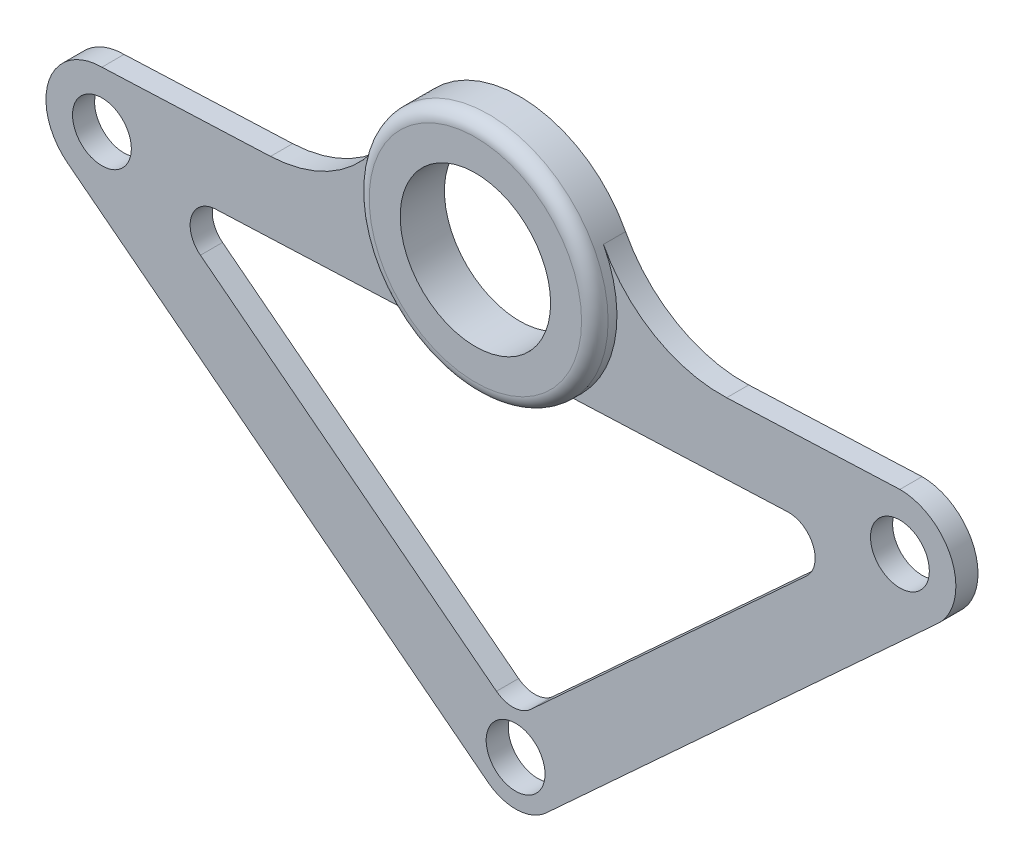
from build123d import *
from build123d.topology import SkipClean

# Parameters (mm, degrees)
SKETCH1_R           = 3.325
SKETCH1_R_2         = 8.5
BOSS_EXTRUDE1_DEPTH = 2.5
SKETCH2_R           = 70.911866835
SKETCH2_R_2         = 13.5
CUT_EXTRUDE1_DEPTH  = 2.5
SKETCH3_R           = 13.5
SKETCH3_R_2         = 8.5
BOSS_EXTRUDE2_DEPTH = 5
FILLET1_R           = 1.5


with BuildPart() as part:
    # Sketch1 → Boss-Extrude1 (new, symmetric)
    with BuildSketch(Plane.XY):
        with BuildLine():
            ThreePointArc((60.622067271, 14.206532436), (59.125498335, 14.810906809), (57.524692071, 15.016834632))
            Line((57.524692071, 15.016834632), (56.997116089, 14.994793348))
            Line((56.997116089, 14.994793348), (37.942484943, 14.198721238))
            ThreePointArc((37.942484943, 14.198721238), (29.810784304, 16.198484397), (24.018273447, 22.245833067))
            ThreePointArc((24.018273447, 22.245833067), (11.4864831, 29.488233713), (-0.397539124, 21.225779345))
            ThreePointArc((-0.397539124, 21.225779345), (-5.665447564, 14.71634399), (-13.602008261, 12.045274491))
            Line((-13.602008261, 12.045274491), (-32.656639407, 11.249202381))
            ThreePointArc((-32.656639407, 11.249202381), (-35.431571333, 10.60798438), (-37.643867273, 8.81434161))
            ThreePointArc((-37.643867273, 8.81434161), (-38.932803958, 4.139738531), (-36.53293032, -0.073796594))
            Line((-36.53293032, -0.073796594), (10.980057512, -36.923376572))
            ThreePointArc((10.980057512, -36.923376572), (14.305396611, -37.984745832), (17.530617501, -36.649704619))
            Line((17.530617501, -36.649704619), (61.804364137, 4.034578786))
            ThreePointArc((61.804364137, 4.034578786), (63.807395856, 9.422079897), (60.622067271, 14.206532436))
        make_face()
        with Locations((14.093347289, -32.909173442)):
            Circle(SKETCH1_R, mode=Mode.SUBTRACT)
        with BuildLine():
            Line((-19.81205116, 3.778850103), (44.820399723, 6.479090855))
            ThreePointArc((44.820399723, 6.479090855), (47.71753436, 4.629103679), (46.975509685, 1.272730481))
            Line((46.975509685, 1.272730481), (15.799754589, -27.375471944))
            ThreePointArc((15.799754589, -27.375471944), (13.895096583, -28.163882109), (11.93131365, -27.537089238))
            Line((11.93131365, -27.537089238), (-21.525382137, -1.589127566))
            ThreePointArc((-21.525382137, -1.589127566), (-22.544780206, 1.693656197), (-19.81205116, 3.778850103))
        make_face(mode=Mode.SUBTRACT)
        with Locations((-32.656639407, 4.924202381)):
            Circle(SKETCH1_R, mode=Mode.SUBTRACT)
        with Locations((12.05, 16)):
            Circle(SKETCH1_R_2, mode=Mode.SUBTRACT)
        with Locations((57.524692071, 8.691834632)):
            Circle(SKETCH1_R, mode=Mode.SUBTRACT)
    extrude(amount=BOSS_EXTRUDE1_DEPTH, both=True)

    # Sketch2 → Cut-Extrude1 (cut)
    with SkipClean():  # the faces are left unmerged after this step: merging them gives an invalid solid
        with BuildSketch(Plane.XY.offset(2.5)):
            with Locations((12.05, 16)):
                Circle(SKETCH2_R)
            with Locations((12.05, 16)):
                Circle(SKETCH2_R_2, mode=Mode.SUBTRACT)
        extrude(amount=-CUT_EXTRUDE1_DEPTH, mode=Mode.SUBTRACT)

    # Sketch3 → Boss-Extrude2 (add)
    with BuildSketch(Plane.XY.offset(2.5)):
        with Locations(Location((12.05, 16, 0), (0, 0, 157.226152371))):
            Circle(SKETCH3_R)
        with Locations((12.05, 16)):
            Circle(SKETCH3_R_2, mode=Mode.SUBTRACT)
    extrude(amount=-BOSS_EXTRUDE2_DEPTH)

    # Fillet1
    fillet1_edges = [part.edges().sort_by_distance(p)[0] for p in [
        (25.161477635, 19.215455525, 2.5),
    ]]
    fillet(fillet1_edges, radius=FILLET1_R)


solid = part.part
